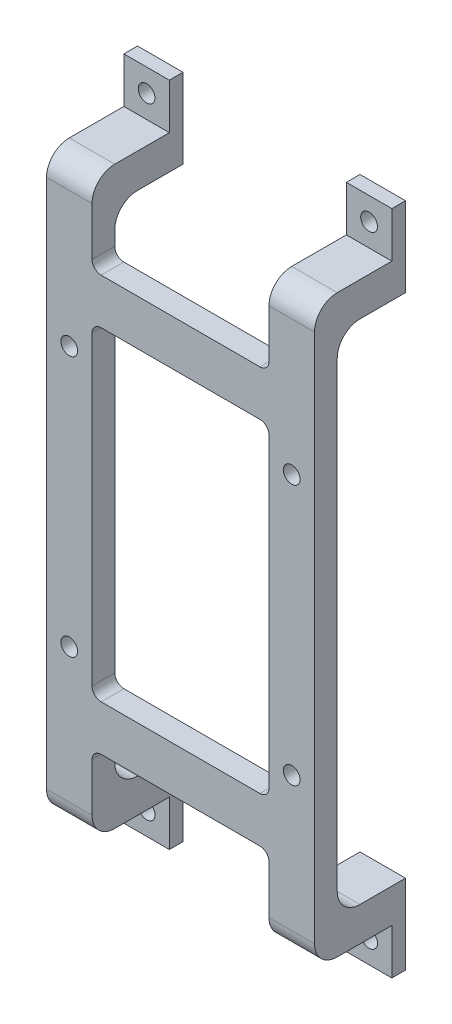
from build123d import *

# Parameters (mm, degrees)
ESQUISSE1_W                = 10
ESQUISSE1_H                = 146.45
BOSS_EXTRU_3_DEPTH         = 3
ESQUISSE3_W                = 10
ESQUISSE3_H                = 126.45
BOSS_EXTRU_4_DEPTH         = 17
ESQUISSE4_R                = 1.84
ENL_V_MAT_EXTRU_1_DEPTH    = 17
ESQUISSE5_R                = 1.84
ENL_V_MAT_EXTRU_2_DEPTH    = 82.419918478
ESQUISSE6_W                = 15
ESQUISSE6_H                = 111.45
ENL_V_MAT_EXTRU_3_DEPTH    = 77.563049998
CONG_1_R                   = 5
CONG_2_R                   = 5
R_P_TITION_LIN_AIRE1_COUNT = 2
R_P_TITION_LIN_AIRE1_PITCH = 48.9
ESQUISSE7_W                = 58.9
ESQUISSE7_H                = 10
BOSS_EXTRU_5_DEPTH         = 5
CONG_4_R                   = 2
ESQUISSE8_W                = 58.9
ESQUISSE8_H                = 10
BOSS_EXTRU_6_DEPTH         = 5
CONG_5_R                   = 2


with BuildPart() as part:
    # Esquisse1 → Boss.-Extru.3 (new body)
    with BuildSketch(Plane.XY):
        with Locations((-24.45, 0)):
            Rectangle(ESQUISSE1_W, ESQUISSE1_H)
    extrude(amount=BOSS_EXTRU_3_DEPTH)

    # Esquisse3 → Boss.-Extru.4 (add)
    with BuildSketch(Plane.XY.offset(3)):
        with Locations((-24.45, 0)):
            Rectangle(ESQUISSE3_W, ESQUISSE3_H)
    extrude(amount=BOSS_EXTRU_4_DEPTH)

    # Esquisse4 → Enlèv. mat.-Extru.1 (cut)
    with BuildSketch(Plane.XY.offset(3)):
        with Locations((-24.45, -68.225)):
            Circle(ESQUISSE4_R)
    enl_v_mat_extru_1 = extrude(amount=-ENL_V_MAT_EXTRU_1_DEPTH, mode=Mode.SUBTRACT)

    # Symétrie1: Enlèv. mat.-Extru.1 across plane
    add(enl_v_mat_extru_1.mirror(Plane.ZX), mode=Mode.SUBTRACT)

    # Esquisse5 → Enlèv. mat.-Extru.2 (cut, through all)
    with BuildSketch(Plane.XY.offset(20)):
        with Locations((-24.45, 28.61)):
            Circle(ESQUISSE5_R)
    enl_v_mat_extru_2 = extrude(amount=-ENL_V_MAT_EXTRU_2_DEPTH, mode=Mode.SUBTRACT)

    # Symétrie2: Enlèv. mat.-Extru.2 across plane
    add(enl_v_mat_extru_2.mirror(Plane.ZX), mode=Mode.SUBTRACT)

    # Esquisse6 → Enlèv. mat.-Extru.3 (cut, through all)
    with BuildSketch(Plane.ZY.offset(29.45)):
        with Locations((7.5, 0)):
            Rectangle(ESQUISSE6_W, ESQUISSE6_H)
    extrude(amount=-ENL_V_MAT_EXTRU_3_DEPTH, mode=Mode.SUBTRACT)

    # Congé1
    cong_1_edges = [part.edges().sort_by_distance(p)[0] for p in [
        (-24.45, -63.225, 20),
        (-24.45, 63.225, 20),
    ]]
    fillet(cong_1_edges, radius=CONG_1_R)

    # Congé2
    cong_2_edges = [part.edges().sort_by_distance(p)[0] for p in [
        (-24.45, 55.725, 15),
        (-24.45, -55.725, 15),
    ]]
    fillet(cong_2_edges, radius=CONG_2_R)


with BuildPart() as r_p_tition_lin_aire1_1:
    # Répétition linéaire1: pattern copy
    add(part.part.moved(Location(Vector(1, 0, 0) * (1 * R_P_TITION_LIN_AIRE1_PITCH))))


with BuildPart() as part_1:
    add(part.part)

    add(r_p_tition_lin_aire1_1.part)  # Boss.-Extru.5 merges Répétition linéaire1_1
    # Esquisse7 → Boss.-Extru.5 (add)
    with BuildSketch(Plane(origin=(0, 0, 15), x_dir=(-1, 0, 0), z_dir=(0, 0, -1))):
        with Locations((0, 40.605950242)):
            Rectangle(ESQUISSE7_W, ESQUISSE7_H)
    extrude(amount=-BOSS_EXTRU_5_DEPTH)

    # Congé4
    cong_4_edges = [part_1.edges().sort_by_distance(p)[0] for p in [
        (-19.45, 45.605950242, 17.5),
        (-19.45, 35.605950242, 17.5),
        (19.45, 35.605950242, 17.5),
        (19.45, 45.605950242, 17.5),
    ]]
    fillet(cong_4_edges, radius=CONG_4_R)

    # Esquisse8 → Boss.-Extru.6 (add)
    with BuildSketch(Plane(origin=(0, 0, 15), x_dir=(-1, 0, 0), z_dir=(0, 0, -1))):
        with Locations((0, -40.605)):
            Rectangle(ESQUISSE8_W, ESQUISSE8_H)
    extrude(amount=-BOSS_EXTRU_6_DEPTH)

    # Congé5
    cong_5_edges = [part_1.edges().sort_by_distance(p)[0] for p in [
        (19.45, -45.605, 17.5),
        (19.45, -35.605, 17.5),
        (-19.45, -35.605, 17.5),
        (-19.45, -45.605, 17.5),
    ]]
    fillet(cong_5_edges, radius=CONG_5_R)


solid = part_1.part
